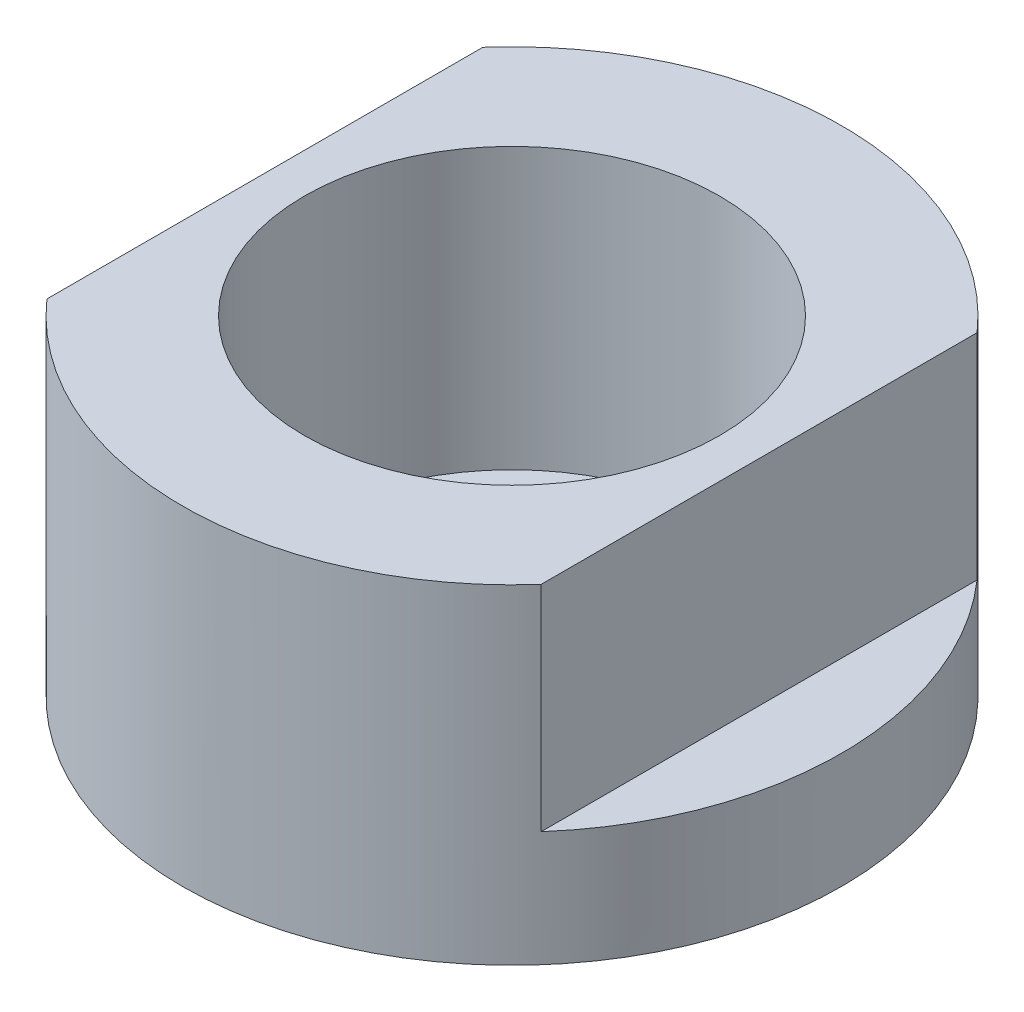
from build123d import *

# Parameters (mm, degrees)
SKETCH1_R                           = 25.4
BOSS_EXTRUDE1_DEPTH                 = 25.4
SKETCH2_R                           = 16
CUT_EXTRUDE1_DEPTH                  = 21.59
CUT_EXTRUDE2_REACH                  = 45.994
CUT_EXTRUDE2_END_RADIUS             = 25.4
SKETCH3_W                           = 6.35
SKETCH3_H                           = 16.51
CUT_EXTRUDE2_DIRECTION_2_REACH      = 45.994
CUT_EXTRUDE2_DIRECTION_2_END_RADIUS = 25.4
CUT_EXTRUDE3_REACH                  = 43.91
SKETCH4_R                           = 1


with BuildPart() as part:
    # Sketch1 → Boss-Extrude1 (new body)
    with BuildSketch(Plane(origin=(0, 0, 0), x_dir=(1, 0, 0), z_dir=(0, 1, 0))):
        with Locations(Location((0, 0, 0), (0, 0, 270))):
            Circle(SKETCH1_R)
    extrude(amount=BOSS_EXTRUDE1_DEPTH)

    # Sketch2 → Cut-Extrude1 (cut)
    with BuildSketch(Plane(origin=(0, 25.4, 0), x_dir=(1, 0, 0), z_dir=(0, 1, 0))):
        with Locations(Location((0, 0, 0), (0, 0, 270))):
            Circle(SKETCH2_R)
    extrude(amount=-CUT_EXTRUDE1_DEPTH, mode=Mode.SUBTRACT)

    # Cut-Extrude2: up to this cylinder (the profile starts inside it)
    cut_extrude2_end = Plane(origin=(0, 17.145, 0), z_dir=(0, -1, 0)) * Cylinder(CUT_EXTRUDE2_END_RADIUS, 143.788, mode=Mode.PRIVATE)
    # Sketch3 → Cut-Extrude2 (cut, up to the surface)
    with BuildSketch(Plane.XY, mode=Mode.PRIVATE) as cut_extrude2_sk1:
        with Locations((22.225, 17.145)):
            Rectangle(SKETCH3_W, SKETCH3_H)
    cut_extrude2_tool1 = extrude(cut_extrude2_sk1.sketch, amount=-CUT_EXTRUDE2_REACH, mode=Mode.PRIVATE) & cut_extrude2_end
    add(cut_extrude2_tool1.solids().sort_by_distance((22.225, 17.145, 0))[0], mode=Mode.SUBTRACT)
    # Sketch3 → Cut-Extrude2 (cut, up to the surface)
    with BuildSketch(Plane.XY, mode=Mode.PRIVATE) as cut_extrude2_sk2:
        with Locations((-22.225, 17.145)):
            Rectangle(SKETCH3_W, SKETCH3_H)
    cut_extrude2_tool2 = extrude(cut_extrude2_sk2.sketch, amount=-CUT_EXTRUDE2_REACH, mode=Mode.PRIVATE) & cut_extrude2_end
    add(cut_extrude2_tool2.solids().sort_by_distance((-22.225, 17.145, 0))[0], mode=Mode.SUBTRACT)

    # Cut-Extrude2 direction 2: up to this cylinder (the profile starts inside it)
    cut_extrude2_direction_2_end = Plane(origin=(0, 17.145, 0), z_dir=(0, -1, 0)) * Cylinder(CUT_EXTRUDE2_DIRECTION_2_END_RADIUS, 143.788, mode=Mode.PRIVATE)
    # Sketch3 → Cut-Extrude2 direction 2 (cut, up to the surface)
    with BuildSketch(Plane.XY, mode=Mode.PRIVATE) as cut_extrude2_direction_2_sk1:
        with Locations((22.225, 17.145)):
            Rectangle(SKETCH3_W, SKETCH3_H)
    cut_extrude2_direction_2_tool1 = extrude(cut_extrude2_direction_2_sk1.sketch, amount=CUT_EXTRUDE2_DIRECTION_2_REACH, mode=Mode.PRIVATE) & cut_extrude2_direction_2_end
    add(cut_extrude2_direction_2_tool1.solids().sort_by_distance((22.225, 17.145, 0))[0], mode=Mode.SUBTRACT)
    # Sketch3 → Cut-Extrude2 direction 2 (cut, up to the surface)
    with BuildSketch(Plane.XY, mode=Mode.PRIVATE) as cut_extrude2_direction_2_sk2:
        with Locations((-22.225, 17.145)):
            Rectangle(SKETCH3_W, SKETCH3_H)
    cut_extrude2_direction_2_tool2 = extrude(cut_extrude2_direction_2_sk2.sketch, amount=CUT_EXTRUDE2_DIRECTION_2_REACH, mode=Mode.PRIVATE) & cut_extrude2_direction_2_end
    add(cut_extrude2_direction_2_tool2.solids().sort_by_distance((-22.225, 17.145, 0))[0], mode=Mode.SUBTRACT)

    # Sketch4 → Cut-Extrude3 (cut, up to next)
    with BuildSketch(Plane(origin=(0, 3.81, 0), x_dir=(1, 0, 0), z_dir=(0, 1, 0)), mode=Mode.PRIVATE) as cut_extrude3_sk1:
        with Locations(Location((0, 8.89, 0), (0, 0, 270))):
            Circle(SKETCH4_R)
    cut_extrude3_tool1 = extrude(cut_extrude3_sk1.sketch, amount=-CUT_EXTRUDE3_REACH, mode=Mode.PRIVATE) & part.part
    # Sketch4 → Cut-Extrude3 (cut, up to next)
    with BuildSketch(Plane(origin=(0, 3.81, 0), x_dir=(1, 0, 0), z_dir=(0, 1, 0)), mode=Mode.PRIVATE) as cut_extrude3_sk2:
        with Locations(Location((7.69896584, -4.445, 0), (0, 0, 270))):
            Circle(SKETCH4_R)
    cut_extrude3_tool2 = extrude(cut_extrude3_sk2.sketch, amount=-CUT_EXTRUDE3_REACH, mode=Mode.PRIVATE) & part.part
    # Sketch4 → Cut-Extrude3 (cut, up to next)
    with BuildSketch(Plane(origin=(0, 3.81, 0), x_dir=(1, 0, 0), z_dir=(0, 1, 0)), mode=Mode.PRIVATE) as cut_extrude3_sk3:
        with Locations(Location((-7.69896584, -4.445, 0), (0, 0, 270))):
            Circle(SKETCH4_R)
    cut_extrude3_tool3 = extrude(cut_extrude3_sk3.sketch, amount=-CUT_EXTRUDE3_REACH, mode=Mode.PRIVATE) & part.part
    add(cut_extrude3_tool1.solids().sort_by_distance((0, 3.81, -8.89))[0], mode=Mode.SUBTRACT)
    add(cut_extrude3_tool2.solids().sort_by_distance((7.698966, 3.81, 4.445))[0], mode=Mode.SUBTRACT)
    add(cut_extrude3_tool3.solids().sort_by_distance((-7.698966, 3.81, 4.445))[0], mode=Mode.SUBTRACT)


solid = part.part
